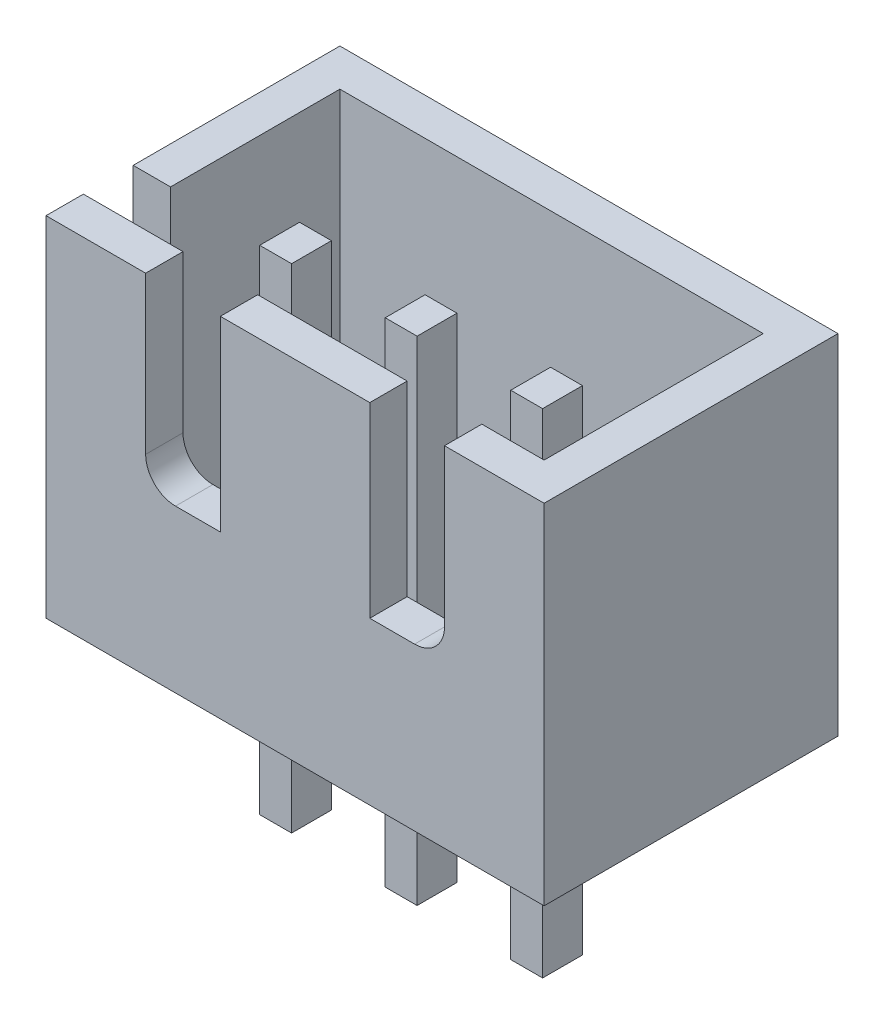
from build123d import *

# Parameters (mm, degrees)
CROQUIS1_W                   = 10
CROQUIS1_H                   = 5.9
CROQUIS1_W_2                 = 0.64
CROQUIS1_H_2                 = 0.8
SALIENTE_EXTRUIR1_DEPTH      = 1
CROQUIS2_W                   = 10
CROQUIS2_H                   = 5.9
CROQUIS2_W_2                 = 8.5
CROQUIS2_H_2                 = 4.4
SALIENTE_EXTRUIR2_DEPTH      = 6
CORTAR_EXTRUIR1_DEPTH        = 9
CORTAR_EXTRUIR2_DEPTH        = 2
SALIENTE_EXTRUIR3_DEPTH      = 6.5
SALIENTE_EXTRUIR3_DEPTH_BACK = 3.4
CROQUIS5_W                   = 0.64
CROQUIS5_H                   = 0.8


with BuildPart() as part:
    # Croquis1 → Saliente-Extruir1 (new body)
    with BuildSketch(Plane(origin=(0, 0, 0), x_dir=(1, 0, 0), z_dir=(0, 1, 0))):
        with Locations((2.52, 0.42)):
            Rectangle(CROQUIS1_W, CROQUIS1_H)
        Rectangle(CROQUIS1_W_2, CROQUIS1_H_2, mode=Mode.SUBTRACT)
        with Locations((5.04, 0)):
            Rectangle(CROQUIS1_W_2, CROQUIS1_H_2, mode=Mode.SUBTRACT)
        with Locations((2.52, 0)):
            Rectangle(CROQUIS1_W_2, CROQUIS1_H_2, mode=Mode.SUBTRACT)
    extrude(amount=SALIENTE_EXTRUIR1_DEPTH)

    # Croquis2 → Saliente-Extruir2 (add)
    with BuildSketch(Plane(origin=(0, 1, 0), x_dir=(1, 0, 0), z_dir=(0, 1, 0))):
        with Locations((2.52, 0.42)):
            Rectangle(CROQUIS2_W, CROQUIS2_H)
        with Locations((2.52, 0.42)):
            Rectangle(CROQUIS2_W_2, CROQUIS2_H_2, mode=Mode.SUBTRACT)
    extrude(amount=SALIENTE_EXTRUIR2_DEPTH)

    # Croquis3 → Cortar-Extruir1 (cut)
    with BuildSketch(Plane.ZY.offset(2.48)):
        with BuildLine():
            Line((1.78, 7), (1.78, 4.35))
            ThreePointArc((1.78, 4.35), (1.604264069, 3.925735931), (1.18, 3.75))
            Line((1.18, 3.75), (0.78, 3.75))
            Line((0.78, 3.75), (0.78, 7))
            Line((0.78, 7), (1.78, 7))
        make_face()
    extrude(amount=-CORTAR_EXTRUIR1_DEPTH, mode=Mode.SUBTRACT)

    # Croquis4 → Cortar-Extruir2 (cut)
    with BuildSketch(Plane.XY.offset(2.53)):
        with BuildLine():
            Line((-0.48, 7), (-0.48, 3.85))
            ThreePointArc((-0.48, 3.85), (-0.304264069, 3.425735931), (0.12, 3.25))
            Line((0.12, 3.25), (1.02, 3.25))
            Line((1.02, 3.25), (1.02, 7))
            Line((1.02, 7), (-0.48, 7))
        make_face()
        with BuildLine():
            Line((5.52, 7), (4.02, 7))
            Line((4.02, 7), (4.02, 3.25))
            Line((4.02, 3.25), (4.92, 3.25))
            ThreePointArc((4.92, 3.25), (5.344264069, 3.425735931), (5.52, 3.85))
            Line((5.52, 3.85), (5.52, 7))
        make_face()
    extrude(amount=-CORTAR_EXTRUIR2_DEPTH, mode=Mode.SUBTRACT)

    # Croquis5 → Saliente-Extruir3 (add, two sides: drawn at the far end of the back side and taken through both)
    with BuildSketch(Plane(origin=(0, 0, 0), x_dir=(1, 0, 0), z_dir=(0, 1, 0)).offset(-SALIENTE_EXTRUIR3_DEPTH_BACK)):
        with Locations((5.04, 0)):
            Rectangle(CROQUIS5_W, CROQUIS5_H)
        Rectangle(CROQUIS5_W, CROQUIS5_H)
        with Locations((2.52, 0)):
            Rectangle(CROQUIS5_W, CROQUIS5_H)
    extrude(amount=SALIENTE_EXTRUIR3_DEPTH + SALIENTE_EXTRUIR3_DEPTH_BACK)


solid = part.part
